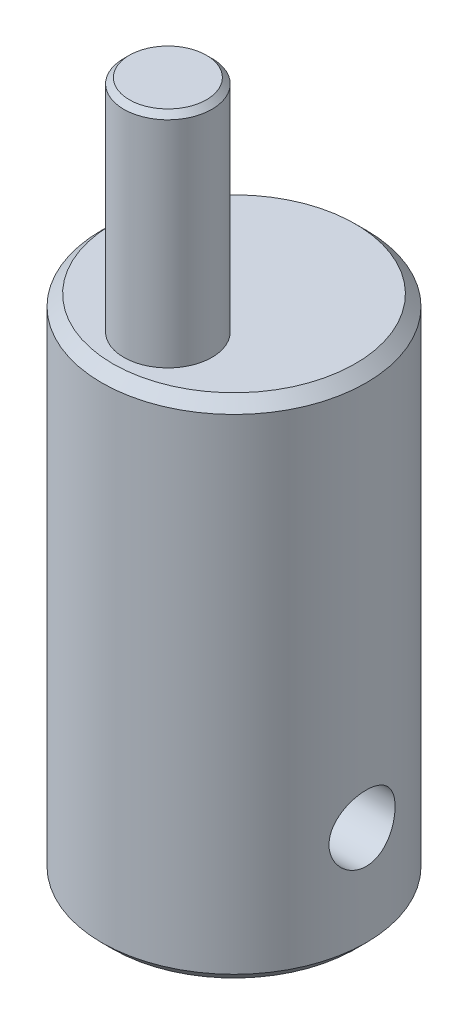
from build123d import *

# Parameters (mm, degrees)
SKETCH1_R               = 6
BOSS_EXTRUDE1_DEPTH     = 23
SKETCH2_R               = 2
BOSS_EXTRUDE2_DEPTH     = 10
CUT_EXTRUDE1_DEPTH      = 35.073450075
CUT_EXTRUDE1_DEPTH_BACK = 35.073450075
SKETCH3_R               = 1.5
CHAMFER1_SIZE           = 0.25
CHAMFER2_SIZE           = 0.5


with BuildPart() as part:
    # Sketch1 → Boss-Extrude1 (new body)
    with BuildSketch(Plane(origin=(0, 0, 0), x_dir=(1, 0, 0), z_dir=(0, 1, 0))):
        with Locations(Location((0, 0, 0), (0, 0, 270))):
            Circle(SKETCH1_R)
    extrude(amount=BOSS_EXTRUDE1_DEPTH)

    # Sketch2 → Boss-Extrude2 (add)
    with BuildSketch(Plane(origin=(0, 23, 0), x_dir=(1, 0, 0), z_dir=(0, 1, 0))):
        with Locations(Location((0, -3, 0), (0, 0, 270))):
            Circle(SKETCH2_R)
    extrude(amount=BOSS_EXTRUDE2_DEPTH)

    # Sketch3 → Cut-Extrude1 (cut, two sides: drawn at the far end of the back side and taken through both)
    with BuildSketch(Plane(origin=(0, 0, 0), x_dir=(0, 0, -1), z_dir=(1, 0, 0)).offset(-CUT_EXTRUDE1_DEPTH_BACK)):
        with Locations((0, 5)):
            Circle(SKETCH3_R)
    extrude(amount=CUT_EXTRUDE1_DEPTH + CUT_EXTRUDE1_DEPTH_BACK, mode=Mode.SUBTRACT)

    # Chamfer1
    chamfer1_edges = [part.edges().sort_by_distance(p)[0] for p in [
        (0, 33, 1),
    ]]
    chamfer(chamfer1_edges, length=CHAMFER1_SIZE)

    # Chamfer2
    chamfer2_edges = [part.edges().sort_by_distance(p)[0] for p in [
        (0, 0, -6),
        (0, 23, -6),
    ]]
    chamfer(chamfer2_edges, length=CHAMFER2_SIZE)


solid = part.part
